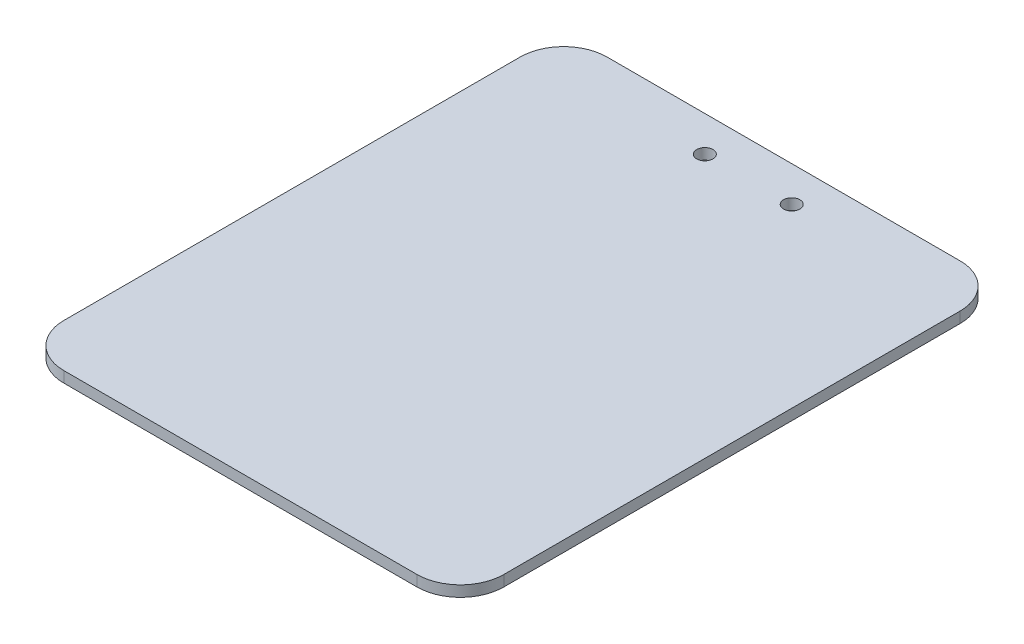
from build123d import *

# Parameters (mm, degrees)
SKETCH1_R           = 1.5
BOSS_EXTRUDE1_DEPTH = 2


with BuildPart() as part:
    # Sketch1 → Boss-Extrude1 (new body)
    with BuildSketch(Plane(origin=(0, 0, 0), x_dir=(1, 0, 0), z_dir=(0, 1, 0))):
        with BuildLine():
            Line((8, 0), (73, 0))
            ThreePointArc((73, 0), (78.656854249, 2.343145751), (81, 8))
            Line((81, 8), (81, 92))
            ThreePointArc((81, 92), (78.656854249, 97.656854249), (73, 100))
            Line((73, 100), (8, 100))
            ThreePointArc((8, 100), (2.343145751, 97.656854249), (0, 92))
            Line((0, 92), (0, 8))
            ThreePointArc((0, 8), (2.343145751, 2.343145751), (8, 0))
        make_face()
        with Locations(Location((48.5, 93.5, 0), (0, 0, 270))):
            Circle(SKETCH1_R, mode=Mode.SUBTRACT)
        with Locations(Location((32.5, 93.5, 0), (0, 0, 90))):
            Circle(SKETCH1_R, mode=Mode.SUBTRACT)
    extrude(amount=BOSS_EXTRUDE1_DEPTH)


solid = part.part
